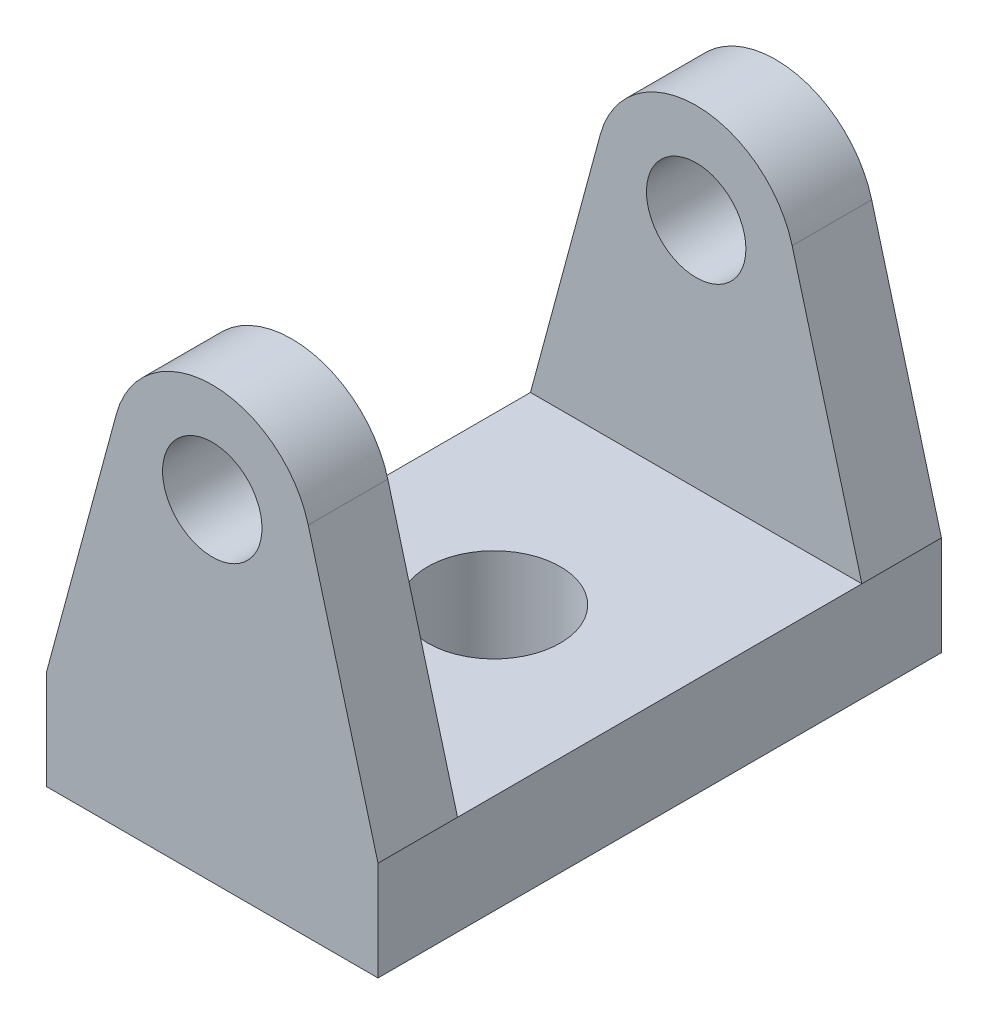
from build123d import *

# Parameters (mm, degrees)
SKETCH1_R           = 15
SKETCH1_R_2         = 7.5
BOSS_EXTRUDE1_DEPTH = 85
SKETCH2_W           = 61
SKETCH2_H           = 50.965296902
CUT_EXTRUDE1_DEPTH  = 71
SKETCH3_R           = 10
CUT_EXTRUDE2_DEPTH  = 23


with BuildPart() as part:
    # Sketch1 → Boss-Extrude1 (new body)
    # profile 1 of 2: a face of its own
    with BuildSketch(Plane.XY):
        with BuildLine():
            Line((0, 15), (0, 0))
            Line((0, 0), (50, 0))
            Line((50, 0), (50, 15))
            Line((50, 15), (39.480230589, 53.914450421))
            ThreePointArc((39.480230589, 53.914450421), (39.869489884, 51.974403855), (40, 50))
            ThreePointArc((40, 50), (23.025596145, 35.130510116), (10.519769411, 53.914450421))
            Line((10.519769411, 53.914450421), (0, 15))
        make_face()
    # profile 2 of 2: a face of its own
    with BuildSketch(Plane.XY):
        with Locations((25, 50)):
            Circle(SKETCH1_R)
        with Locations((25, 50)):
            Circle(SKETCH1_R_2, mode=Mode.SUBTRACT)
    extrude(amount=-BOSS_EXTRUDE1_DEPTH)

    # Sketch2 → Cut-Extrude1 (cut)
    with BuildSketch(Plane(origin=(0, 0, 0), x_dir=(0, 0, -1), z_dir=(1, 0, 0))):
        with Locations((42.5, 40.482648451)):
            Rectangle(SKETCH2_W, SKETCH2_H)
    extrude(amount=CUT_EXTRUDE1_DEPTH, mode=Mode.SUBTRACT)

    # Sketch3 → Cut-Extrude2 (cut)
    with BuildSketch(Plane(origin=(0, 15, 0), x_dir=(1, 0, 0), z_dir=(0, 1, 0))):
        with Locations(Location((25, 42.5, 0), (0, 0, 270))):
            Circle(SKETCH3_R)
    extrude(amount=-CUT_EXTRUDE2_DEPTH, mode=Mode.SUBTRACT)


solid = part.part
